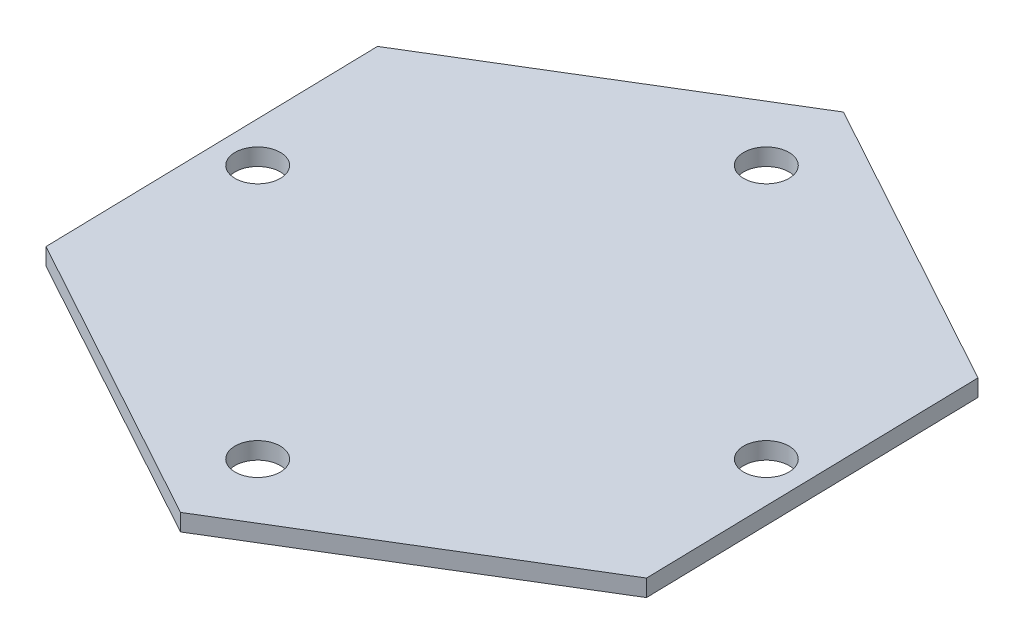
from build123d import *

# Parameters (mm, degrees)
BOSS_EXTRUDE1_DEPTH = 3
SKETCH3_R           = 4
CUT_EXTRUDE1_DEPTH  = 80.870718688


with BuildPart() as part:
    # Sketch2 → Boss-Extrude1 (new body)
    with BuildSketch(Plane(origin=(0, 0, 0), x_dir=(1, 0, 0), z_dir=(0, 1, 0))):
        Polygon((52.633940606, -28.835340667), (51.289107848, 31.164659333), (-1.344832759, 60), (-52.633940606, 28.835340667), (-51.289107848, -31.164659333), (1.344832759, -60), align=None)
    extrude(amount=BOSS_EXTRUDE1_DEPTH)

    # Sketch3 → Cut-Extrude1 (cut, through all)
    with BuildSketch(Plane(origin=(0, 3, 0), x_dir=(1, 0, 0), z_dir=(0, 1, 0))):
        with Locations(Location((-45, 0, 0), (0, 0, 270))):
            Circle(SKETCH3_R)
        with Locations(Location((0, 45, 0), (0, 0, 270))):
            Circle(SKETCH3_R)
        with Locations(Location((45, 0, 0), (0, 0, 270))):
            Circle(SKETCH3_R)
        with Locations(Location((0, -45, 0), (0, 0, 270))):
            Circle(SKETCH3_R)
    extrude(amount=-CUT_EXTRUDE1_DEPTH, mode=Mode.SUBTRACT)


solid = part.part
